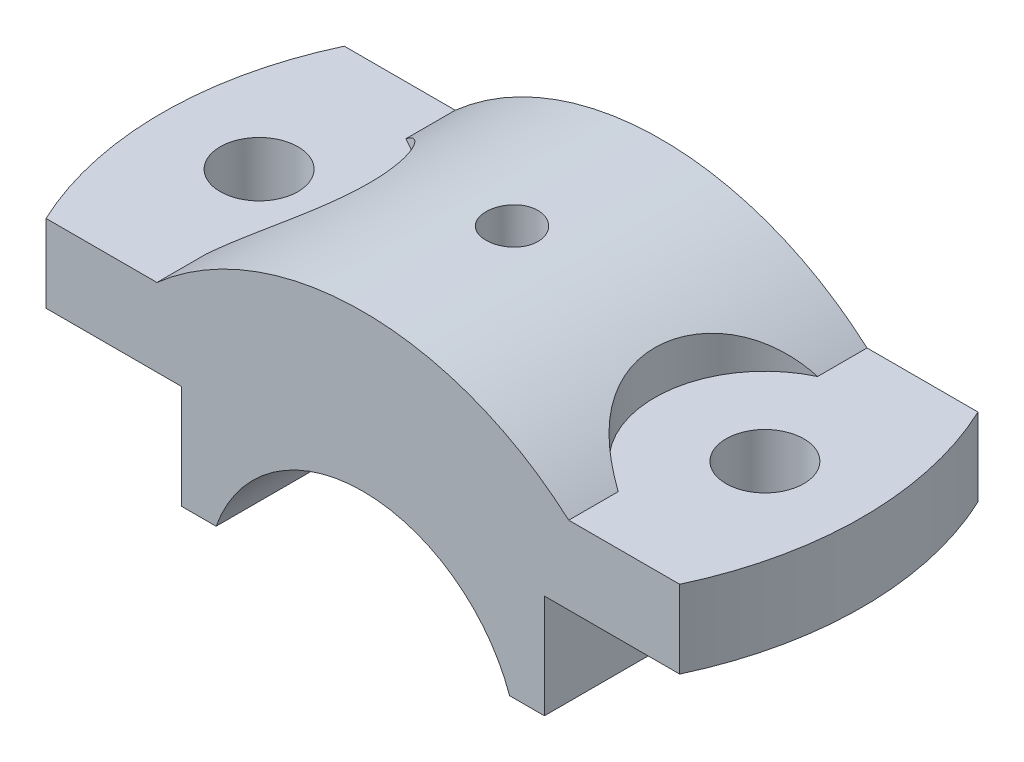
from build123d import *

# Parameters (mm, degrees)
BOSS_EXTRUDE1_DEPTH     = 12
BOSS_EXTRUDE2_DEPTH     = 46
BOSS_EXTRUDE4_DEPTH     = 46
SKETCH4_R               = 6
CUT_EXTRUDE1_DEPTH      = 66.030761952
CUT_EXTRUDE4_DEPTH      = 66.030761952
CUT_EXTRUDE5_DEPTH      = 66.030761987
CUT_EXTRUDE5_DEPTH_BACK = 66.030761987
SKETCH6_R               = 3
SKETCH10_R              = 4
CUT_EXTRUDE6_DEPTH      = 16


with BuildPart() as part:
    # Sketch1 → Boss-Extrude1 (new body)
    with BuildSketch(Plane(origin=(0, 0, 0), x_dir=(1, 0, 0), z_dir=(0, 1, 0))):
        with BuildLine():
            Line((-48.856934001, 23), (48.856934001, 23))
            ThreePointArc((48.856934001, 23), (54, 0), (48.856934001, -23))
            Line((48.856934001, -23), (-48.856934001, -23))
            ThreePointArc((-48.856934001, -23), (-54, 0), (-48.856934001, 23))
        make_face()
    extrude(amount=BOSS_EXTRUDE1_DEPTH)

    # Sketch2 → Boss-Extrude2 (add)
    with BuildSketch(Plane.XY.offset(23)):
        with BuildLine():
            Line((-28, 0.5), (28, 0.5))
            Line((28, 0.5), (28, -16))
            Line((28, -16), (22.627416998, -16))
            ThreePointArc((22.627416998, -16), (0, 0), (-22.627416998, -16))
            Line((-22.627416998, -16), (-28, -16))
            Line((-28, -16), (-28, 0.5))
        make_face()
    extrude(amount=-BOSS_EXTRUDE2_DEPTH)

    # Sketch3 → Boss-Extrude4 (add)
    with BuildSketch(Plane.XY.offset(23)):
        with BuildLine():
            Line((-31.749015733, 12), (31.749015733, 12))
            ThreePointArc((31.749015733, 12), (0, 24), (-31.749015733, 12))
        make_face()
    extrude(amount=-BOSS_EXTRUDE4_DEPTH)

    # Sketch4 → Cut-Extrude1 (cut, through all)
    with BuildSketch(Plane(origin=(0, 12, 0), x_dir=(1, 0, 0), z_dir=(0, 1, 0))):
        with Locations(Location((39, 0, 0), (0, 0, 270))):
            Circle(SKETCH4_R)
        with Locations(Location((-39, 0, 0), (0, 0, 270))):
            Circle(SKETCH4_R)
    extrude(amount=-CUT_EXTRUDE1_DEPTH, mode=Mode.SUBTRACT)

    # Sketch5 → Cut-Extrude4 (cut, through all)
    with BuildSketch(Plane(origin=(0, 12, 0), x_dir=(1, 0, 0), z_dir=(0, 1, 0))):
        with BuildLine():
            Line((-31.749015733, 15.376060196), (-31.749015733, -15.376060196))
            ThreePointArc((-31.749015733, -15.376060196), (-22, 0), (-31.749015733, 15.376060196))
        make_face()
        with BuildLine():
            Line((31.749015733, 15.376060196), (31.749015733, -15.376060196))
            ThreePointArc((31.749015733, -15.376060196), (22, 0), (31.749015733, 15.376060196))
        make_face()
    extrude(amount=CUT_EXTRUDE4_DEPTH, mode=Mode.SUBTRACT)

    # Sketch6 → Cut-Extrude5 (cut, two sides: drawn at the far end of the back side and taken through both)
    with BuildSketch(Plane(origin=(0, 12, 0), x_dir=(1, 0, 0), z_dir=(0, 1, 0)).offset(-CUT_EXTRUDE5_DEPTH_BACK)):
        with Locations(Location((0, 0, 0), (0, 0, 270))):
            Circle(SKETCH6_R)
    extrude(amount=CUT_EXTRUDE5_DEPTH + CUT_EXTRUDE5_DEPTH_BACK, mode=Mode.SUBTRACT)

    # Sketch10 → Cut-Extrude6 (cut)
    with BuildSketch(Plane(origin=(0, 24, 0), x_dir=(1, 0, 0), z_dir=(0, 1, 0))):
        with Locations(Location((0, 0, 0), (0, 0, 270))):
            Circle(SKETCH10_R)
    extrude(amount=-CUT_EXTRUDE6_DEPTH, mode=Mode.SUBTRACT)


solid = part.part
